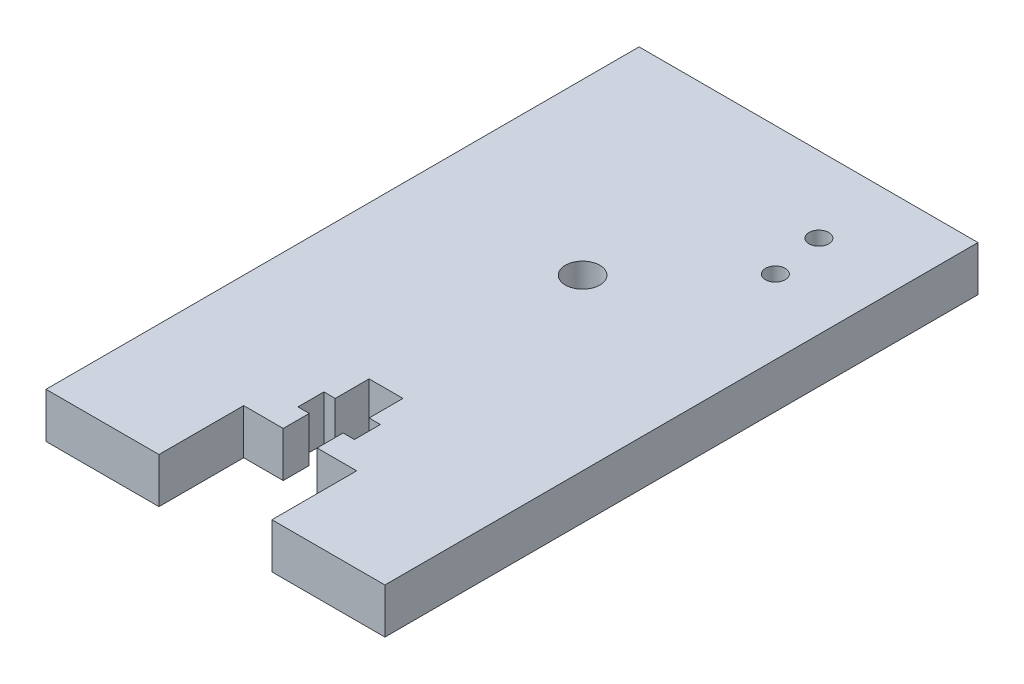
from build123d import *

# Parameters (mm, degrees)
SKETCH1_R           = 3.05
SKETCH1_R_2         = 1.75
BOSS_EXTRUDE1_DEPTH = 8


with BuildPart() as part:
    # Sketch1 → Boss-Extrude1 (new body)
    with BuildSketch(Plane(origin=(0, 0, 0), x_dir=(1, 0, 0), z_dir=(0, 1, 0))):
        Polygon((-10, -37), (-10, -22), (-3, -22), (-3, -17.4), (-5, -17.4), (-5, -12.8), (-3, -12.8), (-3, -6.8), (3, -6.8), (3, -12.8), (5, -12.8), (5, -17.4), (3, -17.4), (3, -22), (10, -22), (10, -37), (30, -37), (30, 38), (30, 58), (30, 68), (-30, 68), (-30, 58), (-30, 38), (-30, -37), align=None)
        with Locations(Location((0, 28, 0), (0, 0, 270))):
            Circle(SKETCH1_R, mode=Mode.SUBTRACT)
        with Locations(Location((16.89444432, 45.232293128, 0), (0, 0, 270))):
            Circle(SKETCH1_R_2, mode=Mode.SUBTRACT)
        with Locations(Location((15.244786632, 54.587966781, 0), (0, 0, 90))):
            Circle(SKETCH1_R_2, mode=Mode.SUBTRACT)
    extrude(amount=BOSS_EXTRUDE1_DEPTH)


solid = part.part
